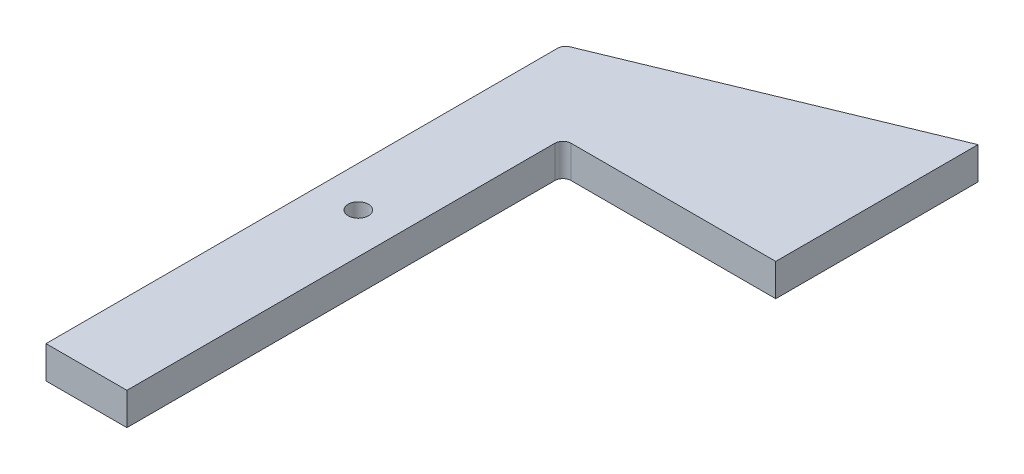
from build123d import *

# Parameters (mm, degrees)
BOSS_EXTRUDE1_DEPTH = 10.16
SKETCH2_R           = 3.175
CUT_EXTRUDE1_DEPTH  = 10.16
FILLET1_R           = 2.54


with BuildPart() as part:
    # Sketch1 → Boss-Extrude1 (new body)
    with BuildSketch(Plane(origin=(0, 0, 0), x_dir=(1, 0, 0), z_dir=(0, 1, 0))):
        Polygon((-50, 128.026), (42.202, 166.126), (42.202, 128.026), (42.202, 102.626), (-24.6, 102.626), (-24.6, -34.28), (-50, -34.28), align=None)
    extrude(amount=BOSS_EXTRUDE1_DEPTH)

    # Sketch2 → Cut-Extrude1 (cut)
    with BuildSketch(Plane(origin=(0, 10.16, 0), x_dir=(1, 0, 0), z_dir=(0, 1, 0))):
        with Locations(Location((-37.3, 51.064, 0), (0, 0, 270))):
            Circle(SKETCH2_R)
    extrude(amount=-CUT_EXTRUDE1_DEPTH, mode=Mode.SUBTRACT)

    # Fillet1
    fillet1_edges = [part.edges().sort_by_distance(p)[0] for p in [
        (-50, 5.08, -128.026),
        (-24.6, 5.08, -102.626),
    ]]
    fillet(fillet1_edges, radius=FILLET1_R)


solid = part.part
